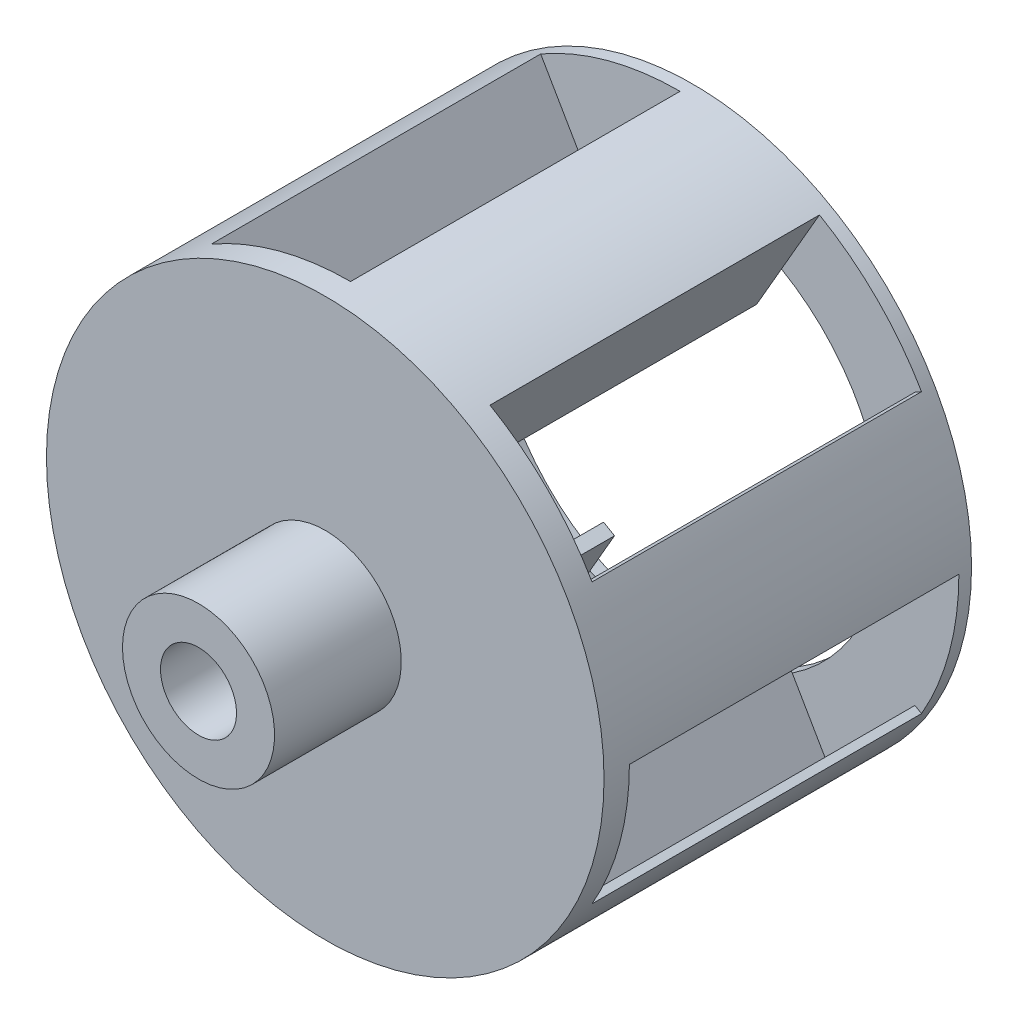
from build123d import *
from build123d.topology import SkipClean

# Parameters (mm, degrees)
BOSS_EXTRUDE1_START = 6.5
BOSS_EXTRUDE1_DEPTH = 6.5
BOSS_EXTRUDE2_START = 0.25
SKETCH3_R           = 5.5
SKETCH3_R_2         = 4
BOSS_EXTRUDE2_DEPTH = 0.25


with BuildPart() as part:
    # Sketch1 → Revolve1 (revolve)
    with BuildSketch(Plane(origin=(0, 0, 0), x_dir=(1, 0, 0), z_dir=(0, 1, 0)), mode=Mode.PRIVATE) as revolve1_sk:
        Polygon((5.5, 0.5), (0.75, 0.5), (0.75, -2.5), (1.5, -2.5), (1.5, 0), (5.5, 0), align=None)
    revolve(revolve1_sk.sketch.rotate(Axis((0, 0, -4.303790718), (0, 0, 1)), 180), axis=Axis((0, 0, -4.303790718), (0, 0, 1)))

    # Sketch2 → Boss-Extrude1 (add)
    with SkipClean():  # the faces are left unmerged after this step: merging them gives an invalid solid
        with BuildSketch(Plane(origin=(0, 0, -0.5), x_dir=(-1, 0, 0), z_dir=(0, 0, -1)).offset(BOSS_EXTRUDE1_START)):
            with BuildLine():
                Line((5.5, 0), (3.02, 0))
                Line((3.02, 0), (3.02, -0.25))
                Line((3.02, -0.25), (5.344155686, -0.25))
                ThreePointArc((5.344155686, -0.25), (5.133930465, -1.505077401), (4.63323591, -2.675))
                Line((4.63323591, -2.675), (4.763139721, -2.75))
                ThreePointArc((4.763139721, -2.75), (5.312592045, -1.423504748), (5.5, 0))
            make_face()
            with BuildLine():
                Line((2.75, -4.763139721), (1.51, -2.615396719))
                Line((1.51, -2.615396719), (1.293493649, -2.740396719))
                Line((1.293493649, -2.740396719), (2.455571492, -4.753174586))
                ThreePointArc((2.455571492, -4.753174586), (1.263529969, -5.198652904), (0, -5.35))
                Line((0, -5.35), (0, -5.5))
                ThreePointArc((0, -5.5), (1.423504748, -5.312592045), (2.75, -4.763139721))
            make_face()
            with BuildLine():
                Line((-2.75, -4.763139721), (-1.51, -2.615396719))
                Line((-1.51, -2.615396719), (-1.726506351, -2.490396719))
                Line((-1.726506351, -2.490396719), (-2.888584194, -4.503174586))
                ThreePointArc((-2.888584194, -4.503174586), (-3.870400496, -3.693575503), (-4.63323591, -2.675))
                Line((-4.63323591, -2.675), (-4.763139721, -2.75))
                ThreePointArc((-4.763139721, -2.75), (-3.889087297, -3.889087297), (-2.75, -4.763139721))
            make_face()
            with BuildLine():
                Line((-5.5, 0), (-3.02, 0))
                Line((-3.02, 0), (-3.02, 0.25))
                Line((-3.02, 0.25), (-5.344155686, 0.25))
                ThreePointArc((-5.344155686, 0.25), (-5.133930465, 1.505077401), (-4.63323591, 2.675))
                Line((-4.63323591, 2.675), (-4.763139721, 2.75))
                ThreePointArc((-4.763139721, 2.75), (-5.312592045, 1.423504748), (-5.5, 0))
            make_face()
            with BuildLine():
                Line((-2.75, 4.763139721), (-1.51, 2.615396719))
                Line((-1.51, 2.615396719), (-1.293493649, 2.740396719))
                Line((-1.293493649, 2.740396719), (-2.455571492, 4.753174586))
                ThreePointArc((-2.455571492, 4.753174586), (-1.263529969, 5.198652904), (0, 5.35))
                Line((0, 5.35), (0, 5.5))
                ThreePointArc((0, 5.5), (-1.423504748, 5.312592045), (-2.75, 4.763139721))
            make_face()
            with BuildLine():
                Line((2.75, 4.763139721), (1.51, 2.615396719))
                Line((1.51, 2.615396719), (1.726506351, 2.490396719))
                Line((1.726506351, 2.490396719), (2.888584194, 4.503174586))
                ThreePointArc((2.888584194, 4.503174586), (3.870400496, 3.693575503), (4.63323591, 2.675))
                Line((4.63323591, 2.675), (4.763139721, 2.75))
                ThreePointArc((4.763139721, 2.75), (3.889087297, 3.889087297), (2.75, 4.763139721))
            make_face()
        extrude(amount=-BOSS_EXTRUDE1_DEPTH)

    # Sketch3 → Boss-Extrude2 (add)
    with SkipClean():  # the faces are left unmerged after this step: merging them gives an invalid solid
        with BuildSketch(Plane(origin=(0, 0, -7), x_dir=(-1, 0, 0), z_dir=(0, 0, -1)).offset(BOSS_EXTRUDE2_START)):
            Circle(SKETCH3_R)
            Circle(SKETCH3_R_2, mode=Mode.SUBTRACT)
        extrude(amount=-BOSS_EXTRUDE2_DEPTH)


solid = part.part
